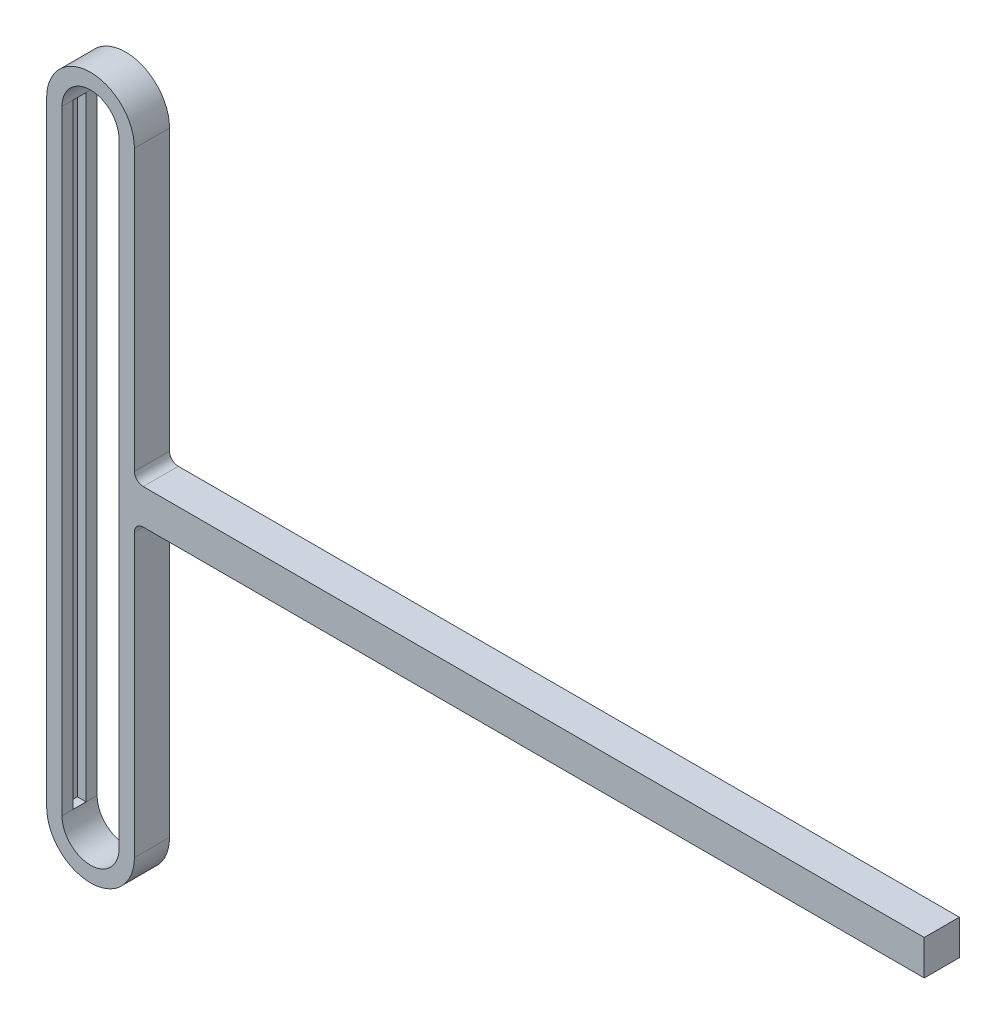
from build123d import *

# Parameters (mm, degrees)
SKETCH1_W           = 100
SKETCH1_H           = 800
BOSS_EXTRUDE1_DEPTH = 40
FILLET1_RADIUS      = 50
FILLET1_LENGTH      = 40
FILLET2_RADIUS      = 50
FILLET2_LENGTH      = 40
CUT_EXTRUDE1_DEPTH  = 406.092582011
SKETCH3_W           = 15
SKETCH3_H           = 700
CUT_EXTRUDE2_DEPTH  = 10
SKETCH4_W           = 40
SKETCH4_H           = 40
BOSS_EXTRUDE2_DEPTH = 900
FILLET3_R           = 10


with BuildPart() as part:
    # Sketch1 → Boss-Extrude1 (new body)
    with BuildSketch(Plane.XY):
        Rectangle(SKETCH1_W, SKETCH1_H)
    extrude(amount=BOSS_EXTRUDE1_DEPTH)

    # Fillet1: full round fillet: the end face becomes a half cylinder, R = half its width
    fillet1_face = Plane((0, 400, 20), x_dir=(0, 0, 1), z_dir=(0, 1, 0))  # on the end face: x along it, z out of the body
    fillet1_slab = fillet1_face.offset(-FILLET1_RADIUS / 2) * Box(FILLET1_LENGTH, 2 * FILLET1_RADIUS, FILLET1_RADIUS, mode=Mode.PRIVATE)  # the body's end, R deep
    fillet1_round = Plane((0, 350, 20), x_dir=(0, 1, 0), z_dir=(0, 0, 1)) * Cylinder(FILLET1_RADIUS, FILLET1_LENGTH, mode=Mode.PRIVATE)  # its axis R under the face
    add(fillet1_slab - fillet1_round, mode=Mode.SUBTRACT)

    # Fillet2: full round fillet: the end face becomes a half cylinder, R = half its width
    fillet2_face = Plane((0, -400, 20), x_dir=(0, 0, 1), z_dir=(0, -1, 0))  # on the end face: x along it, z out of the body
    fillet2_slab = fillet2_face.offset(-FILLET2_RADIUS / 2) * Box(FILLET2_LENGTH, 2 * FILLET2_RADIUS, FILLET2_RADIUS, mode=Mode.PRIVATE)  # the body's end, R deep
    fillet2_round = Plane((0, -350, 20), x_dir=(0, -1, 0), z_dir=(0, 0, 1)) * Cylinder(FILLET2_RADIUS, FILLET2_LENGTH, mode=Mode.PRIVATE)  # its axis R under the face
    add(fillet2_slab - fillet2_round, mode=Mode.SUBTRACT)

    # Sketch2 → Cut-Extrude1 (cut, through all)
    with BuildSketch(Plane(origin=(0, 0, 0), x_dir=(-1, 0, 0), z_dir=(0, 0, -1))):
        with BuildLine():
            Line((-32.5, 350), (-32.5, -350))
            ThreePointArc((-32.5, -350), (0, -382.5), (32.5, -350))
            Line((32.5, -350), (32.5, 350))
            ThreePointArc((32.5, 350), (0, 382.5), (-32.5, 350))
        make_face()
    extrude(amount=-CUT_EXTRUDE1_DEPTH, mode=Mode.SUBTRACT)

    # Sketch3 → Cut-Extrude2 (cut)
    with BuildSketch(Plane(origin=(-32.5, 0, 0), x_dir=(0, 0, -1), z_dir=(1, 0, 0))):
        with Locations((-20, 0)):
            Rectangle(SKETCH3_W, SKETCH3_H)
    cut_extrude2 = extrude(amount=-CUT_EXTRUDE2_DEPTH, mode=Mode.SUBTRACT)

    # Mirror1: Cut-Extrude2 across plane
    add(cut_extrude2.mirror(Plane(origin=(0, 0, 0), x_dir=(0, 0, 1), z_dir=(1, 0, 0))), mode=Mode.SUBTRACT)

    # Sketch4 → Boss-Extrude2 (add)
    with BuildSketch(Plane(origin=(50, 0, 0), x_dir=(0, 0, -1), z_dir=(1, 0, 0))):
        with Locations((-20, 1.179779929)):
            Rectangle(SKETCH4_W, SKETCH4_H)
    extrude(amount=BOSS_EXTRUDE2_DEPTH)

    # Fillet3
    fillet3_edges = [part.edges().sort_by_distance(p)[0] for p in [
        (50, 21.179779929, 20),
        (50, -18.820220071, 20),
    ]]
    fillet(fillet3_edges, radius=FILLET3_R)


solid = part.part
